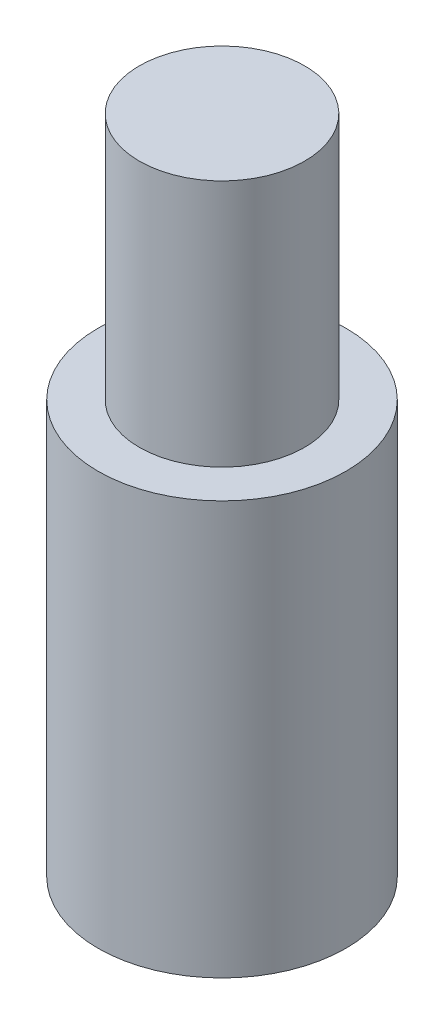
from build123d import *

# Parameters (mm, degrees)
ESBO_O1_R                = 15
RESSALTO_EXTRUS_O1_DEPTH = 50
ESBO_O2_R                = 10
RESSALTO_EXTRUS_O2_DEPTH = 30


with BuildPart() as part:
    # Esboço1 → Ressalto-extrusão1 (new body)
    with BuildSketch(Plane(origin=(0, 0, 0), x_dir=(1, 0, 0), z_dir=(0, 1, 0))):
        with Locations(Location((0, 0, 0), (0, 0, 270))):
            Circle(ESBO_O1_R)
    extrude(amount=RESSALTO_EXTRUS_O1_DEPTH)

    # Esboço2 → Ressalto-extrusão2 (add)
    with BuildSketch(Plane(origin=(0, 50, 0), x_dir=(1, 0, 0), z_dir=(0, 1, 0))):
        with Locations(Location((0, 0, 0), (0, 0, 270))):
            Circle(ESBO_O2_R)
    extrude(amount=RESSALTO_EXTRUS_O2_DEPTH)


solid = part.part
